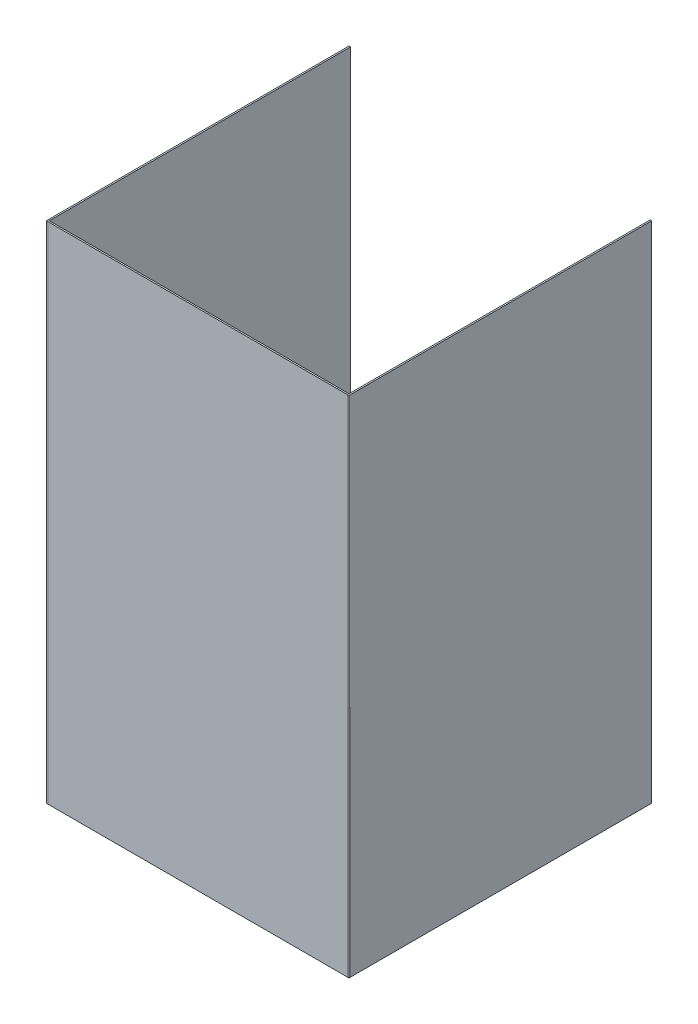
from build123d import *

# Parameters (mm, degrees)
SKETCH1_W           = 300
SKETCH1_H           = 500
BOSS_EXTRUDE1_DEPTH = 1.5
SKETCH2_W           = 300
SKETCH2_H           = 500
BOSS_EXTRUDE2_DEPTH = 1.5
SKETCH3_W           = 300
SKETCH3_H           = 500
BOSS_EXTRUDE3_DEPTH = 1.5
SKETCH4_W           = 300
SKETCH4_H           = 300
BOSS_EXTRUDE5_DEPTH = 1.5


with BuildPart() as part:
    # Sketch1 → Boss-Extrude1 (new body)
    with BuildSketch(Plane.XY):
        Rectangle(SKETCH1_W, SKETCH1_H)
    extrude(amount=-BOSS_EXTRUDE1_DEPTH)


with BuildPart() as body_2:
    # Sketch2 → Boss-Extrude2 (new body)
    with BuildSketch(Plane(origin=(150, 0, 0), x_dir=(0, 0, -1), z_dir=(1, 0, 0))):
        with Locations((150, 0)):
            Rectangle(SKETCH2_W, SKETCH2_H)
    extrude(amount=-BOSS_EXTRUDE2_DEPTH)


with BuildPart() as body_3:
    # Sketch3 → Boss-Extrude3 (new body)
    with BuildSketch(Plane.ZY.offset(150)):
        with Locations((-150, 0)):
            Rectangle(SKETCH3_W, SKETCH3_H)
    extrude(amount=-BOSS_EXTRUDE3_DEPTH)


with BuildPart() as body_4:
    # Sketch4 → Boss-Extrude5 (new body)
    with BuildSketch(Plane.XZ.offset(250)):
        with Locations((0, -150)):
            Rectangle(SKETCH4_W, SKETCH4_H)
    extrude(amount=-BOSS_EXTRUDE5_DEPTH)


solid = Compound([part.part, body_2.part, body_3.part, body_4.part])
